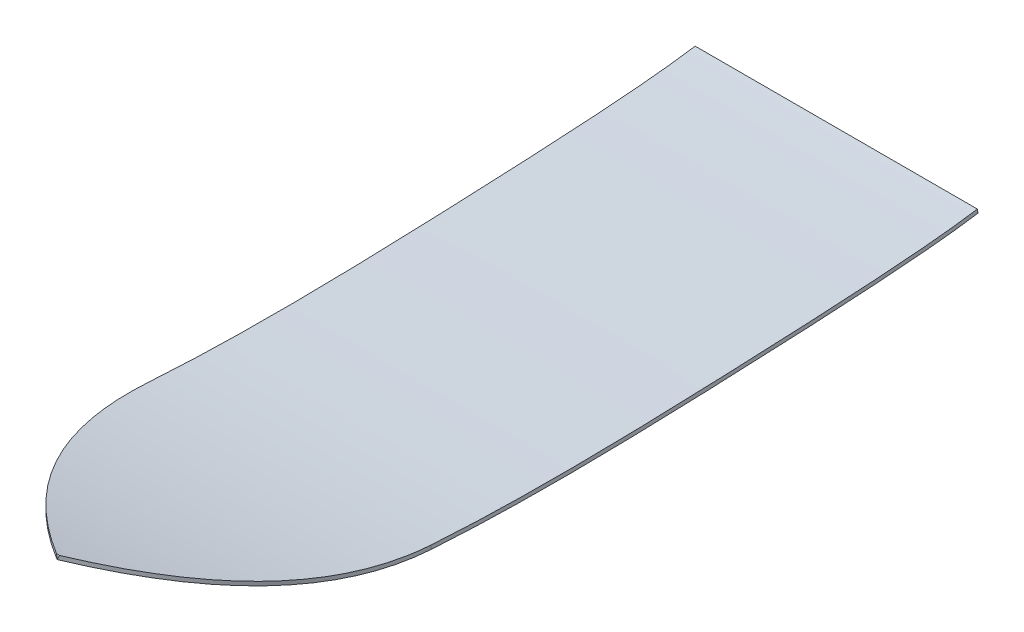
from build123d import *

# Parameters (mm, degrees)
BOSS_EXTRUDE1_DEPTH      = 1524
BOSS_EXTRUDE1_DEPTH_BACK = 1524
CUT_EXTRUDE1_DEPTH       = 2943.059650945
CUT_EXTRUDE1_DEPTH_BACK  = 2943.059650945
SKETCH3_W                = 5731.45735109
SKETCH3_H                = 8003.305882061


with BuildPart() as part:
    # Sketch1 → Boss-Extrude1 (new, two sides: drawn at the far end of the back side and taken through both)
    with BuildSketch(Plane(origin=(0, 0, 0), x_dir=(0, 0, -1), z_dir=(1, 0, 0)).offset(-BOSS_EXTRUDE1_DEPTH_BACK)):
        with BuildLine():
            Line((-2455.469795203, 134.982584989), (-2461.946867905, 110.836207844))
            add(Edge.make_bspline(
                [(-2461.946867905, 110.836207844), (-2428.452454134, 101.851599023), (-2361.285055475, 84.380636059), (-2260.397416672, 59.757088381), (-2159.761635292, 36.793231067), (-2026.416712424, 8.419070411), (-1862.259613973, -22.771190965), (-1671.720773956, -53.642483873), (-1489.212588749, -78.568574593), (-1344.464506506, -95.036671651), (-1233.138166711, -106.037152001), (-1151.835634643, -113.293448685), (-1072.720104831, -119.649113234), (-995.656507701, -125.194830929), (-919.827078977, -130.054953908), (-820.229150889, -135.691467), (-698.109772524, -141.299771894), (-554.265352606, -146.076517589), (-412.209973939, -149.166562234), (-271.176085636, -150.779794024), (-130.475199863, -151.088124068), (10.498921915, -150.218189422), (152.356622959, -148.29649633), (295.695003648, -145.410785117), (441.110930622, -141.649435), (589.24959068, -137.080108779), (715.554683808, -132.650116292), (818.712690962, -128.759488748), (897.242215664, -125.674158083), (977.053458684, -122.426989504), (1058.325619128, -119.02447596), (1140.260747115, -115.493320111), (1250.138794963, -110.59947135), (1388.107475048, -104.112588093), (1552.761618525, -95.674011047), (1714.568596677, -86.517592644), (1871.563093469, -76.579315743), (1996.719198485, -67.592672856), (2092.446728836, -59.947910487), (2161.793566025, -53.978340482), (2228.44208922, -47.764331788), (2292.147579141, -41.297541749), (2342.580611439, -35.690527324), (2381.214018357, -31.069270133), (2409.302935957, -27.534170731), (2436.476202003, -23.928516792), (2458.333631626, -20.863671926), (2475.332437705, -18.374960113), (2487.836149169, -16.489493186), (2498.042759678, -14.903219145), (2506.091386595, -13.622923371), (2510.054516109, -12.982577579), (2512.043123723, -12.658699204)],
                knots=[0.002321774, 0.002321774, 0.002321774, 0.002321774, 0.017910496, 0.033499218, 0.04908794, 0.064676663, 0.095854107, 0.127031552, 0.158208996, 0.189386441, 0.204975163, 0.220563886, 0.236152608, 0.25174133, 0.267330052, 0.282918775, 0.314096219, 0.345273664, 0.376451108, 0.407628553, 0.438805998, 0.469983442, 0.501160887, 0.532338331, 0.563515776, 0.59469322, 0.625870665, 0.641459387, 0.65704811, 0.672636832, 0.688225554, 0.703814277, 0.719402999, 0.750580443, 0.781757888, 0.812935333, 0.844112777, 0.875290222, 0.890878944, 0.906467666, 0.922056389, 0.937645111, 0.953233833, 0.961028194, 0.968822555, 0.976616917, 0.984411278, 0.988308458, 0.992205639, 0.996102819, 0.99805141, 1, 1, 1, 1], degree=3))
            Line((2512.043123723, -12.658699204), (2508.024401726, 12.016184251))
            add(Edge.make_bspline(
                [(-2455.469795203, 134.982584989), (-2393.538232798, 118.369938304), (-2264.077181915, 85.593021179), (-2101.603931139, 49.455314159), (-1969.547516865, 23.077231143), (-1839.19034436, -1.053318098), (-1680.16862393, -27.101726049), (-1497.281175159, -52.36243611), (-1308.647803756, -74.074039485), (-1178.754210679, -86.021252618), (-1099.670117715, -92.377061515), (-1063.668227169, -95.193075408), (-1031.438389418, -97.559564994), (-954.7714481, -102.883269349), (-851.250730233, -109.185143542), (-704.535974162, -116.026081011), (-560.548566736, -120.89464959), (-418.370045647, -124.061274937), (-230.174228774, -126.297397992), (4.222216455, -125.804937152), (241.571680644, -121.779938852), (435.623631421, -116.795611583), (583.89462031, -112.243684307), (735.605527533, -106.939667032), (865.564761, -101.937822414), (958.768657742, -98.151766972), (1012.774918748, -95.909487536), (1094.326010114, -92.474741575), (1217.952390669, -87.079235245), (1383.807646154, -79.293536673), (1548.760756574, -70.853344494), (1764.88706881, -58.642627354), (1971.322893498, -44.869434749), (2254.31940598, -21.490500859), (2413.84111278, -3.323156895), (2508.024401726, 12.016184251)],
                knots=[0.002321774, 0.002321774, 0.002321774, 0.002321774, 0.03125, 0.0625, 0.078125, 0.09375, 0.125, 0.15625, 0.1875, 0.2265625, 0.23046875, 0.234375, 0.248046875, 0.25, 0.28125, 0.3125, 0.34375, 0.375, 0.40625, 0.46875, 0.53125, 0.5625, 0.59375, 0.625, 0.65625, 0.671875, 0.6796875, 0.6875, 0.71875, 0.75, 0.78125, 0.8125, 0.875, 0.90625, 1, 1, 1, 1], degree=3))
        make_face()
    extrude(amount=BOSS_EXTRUDE1_DEPTH + BOSS_EXTRUDE1_DEPTH_BACK)

    # Sketch3 → Cut-Extrude1 (cut, two sides: drawn at the far end of the back side and taken through both)
    with BuildSketch(Plane(origin=(0, 0, 0), x_dir=(1, 0, 0), z_dir=(0, 1, 0)).offset(-CUT_EXTRUDE1_DEPTH_BACK)):
        with Locations((-68.47307406, 1370.374733043)):
            Rectangle(SKETCH3_W, SKETCH3_H)
        with BuildLine():
            Line((-900, 2541.766216977), (900, 2541.766216977))
            Line((900, 2541.766216977), (900, -975.767433575))
            add(Edge.make_bspline(
                [(900, -975.767433575), (900, -1850.406038758), (0, -2461.946867905)],
                knots=[0, 0, 0, 1, 1, 1], degree=2))
            add(Edge.make_bspline(
                [(-900, -975.767433575), (-900, -1850.406038758), (0, -2461.946867905)],
                knots=[0, 0, 0, 1, 1, 1], degree=2))
            Line((-900, -975.767433575), (-900, 2541.766216977))
        make_face(mode=Mode.SUBTRACT)
    extrude(amount=CUT_EXTRUDE1_DEPTH + CUT_EXTRUDE1_DEPTH_BACK, mode=Mode.SUBTRACT)


solid = part.part
